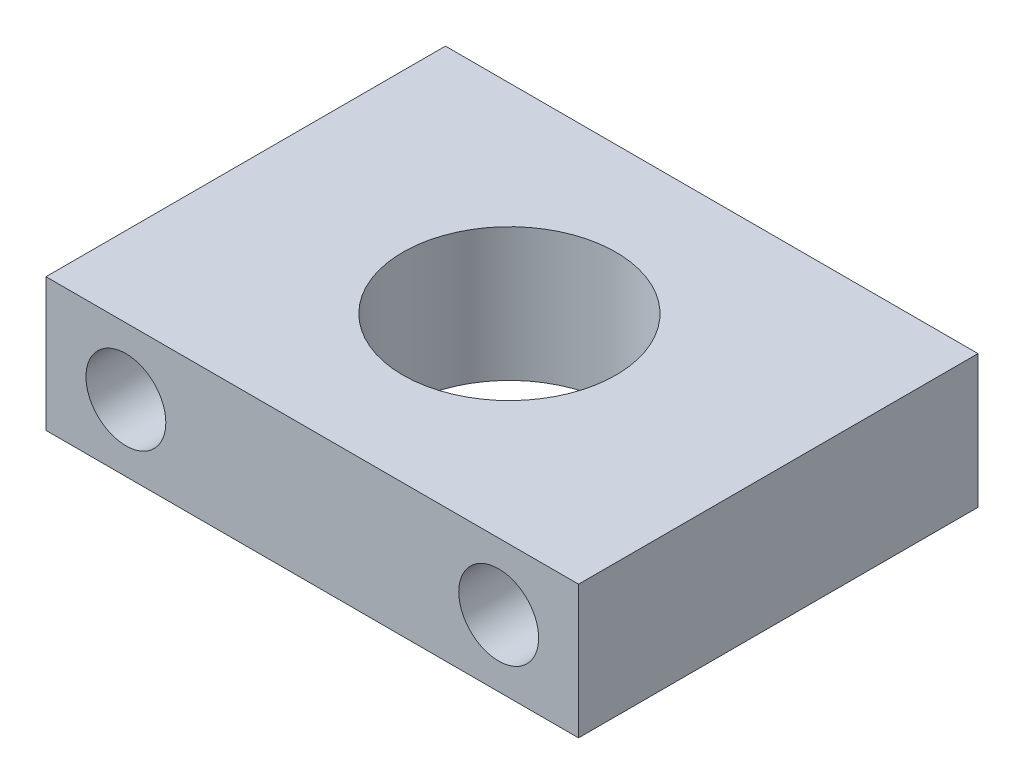
from build123d import *

# Parameters (mm, degrees)
SKETCH1_W           = 20
SKETCH1_H           = 15
BOSS_EXTRUDE1_DEPTH = 5
SKETCH2_R           = 1.5
CUT_EXTRUDE1_DEPTH  = 24.203994107
SKETCH3_R           = 4
CUT_EXTRUDE2_DEPTH  = 5


with BuildPart() as part:
    # Sketch1 → Boss-Extrude1 (new body)
    with BuildSketch(Plane(origin=(0, 0, 0), x_dir=(1, 0, 0), z_dir=(0, 1, 0))):
        with Locations((-6.983089899, -4.822749115)):
            Rectangle(SKETCH1_W, SKETCH1_H)
    extrude(amount=BOSS_EXTRUDE1_DEPTH)

    # Sketch2 → Cut-Extrude1 (cut, through all)
    with BuildSketch(Plane.XY.offset(12.322749115)):
        with Locations((-13.983089899, 2.5)):
            Circle(SKETCH2_R)
        with Locations(Location((0.016910101, 2.5, 0), (0, 0, 180))):
            Circle(SKETCH2_R)
    extrude(amount=-CUT_EXTRUDE1_DEPTH, mode=Mode.SUBTRACT)

    # Sketch3 → Cut-Extrude2 (cut)
    with BuildSketch(Plane(origin=(0, 5, 0), x_dir=(1, 0, 0), z_dir=(0, 1, 0))):
        with Locations(Location((-7.080321074, -4.822749115, 0), (0, 0, 270))):
            Circle(SKETCH3_R)
    extrude(amount=-CUT_EXTRUDE2_DEPTH, mode=Mode.SUBTRACT)


solid = part.part
